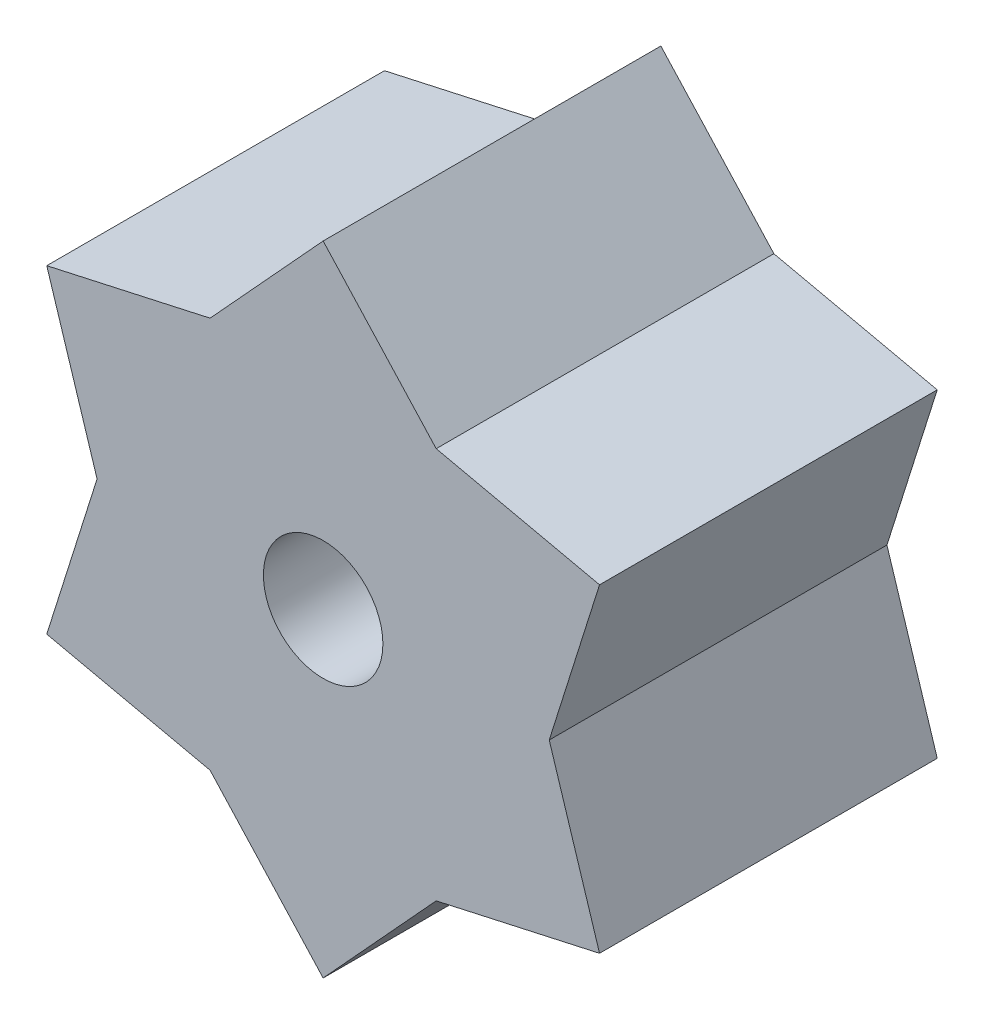
from build123d import *

# Parameters (mm, degrees)
SKETCH1_R           = 1.15
BOSS_EXTRUDE1_DEPTH = 6.5


with BuildPart() as part:
    # Sketch1 → Boss-Extrude1 (new body)
    with BuildSketch(Plane.XY):
        Polygon((0, -6.142777017), (2.175697935, -3.768419365), (5.319800946, -3.071388508), (4.351395869, 0), (5.319800946, 3.071388508), (2.175697935, 3.768419365), (0, 6.142777017), (-2.175697935, 3.768419365), (-5.319800946, 3.071388508), (-4.351395869, 0), (-5.319800946, -3.071388508), (-2.175697935, -3.768419365), align=None)
        Circle(SKETCH1_R, mode=Mode.SUBTRACT)
    extrude(amount=-BOSS_EXTRUDE1_DEPTH)


solid = part.part
